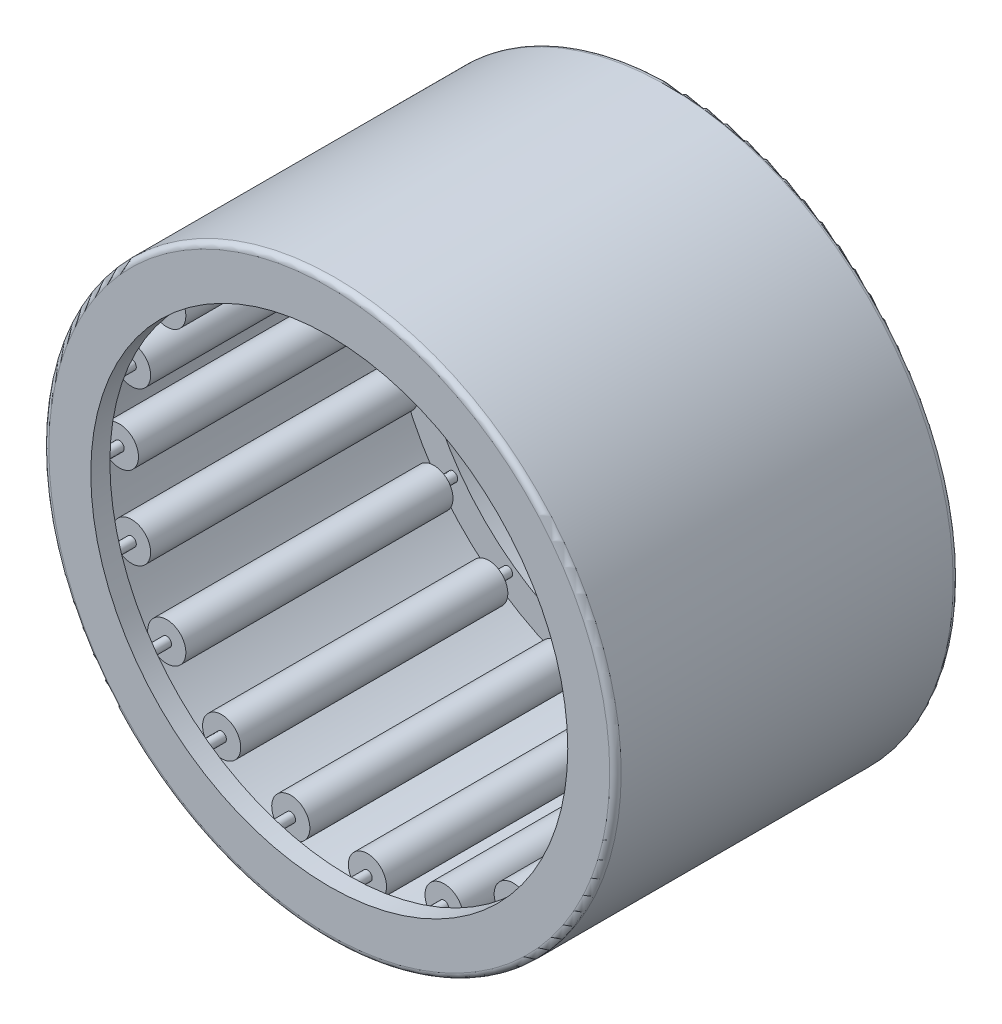
from build123d import *

# Parameters (mm, degrees)
SKETCH2_W         = 14.816666666
SKETCH2_H         = 0.79375
SKETCH3_W         = 16.933333334
SKETCH3_H         = 0.264583334
CIRPATTERN1_COUNT = 20
CIRPATTERN1_ANGLE = 342
FILLET1_R         = 0.3175


with BuildPart() as part:
    # Sketch1 → Revolve1 (revolve)
    with BuildSketch(Plane(origin=(0, 0, 0), x_dir=(0, 0, -1), z_dir=(1, 0, 0)), mode=Mode.PRIVATE) as revolve1_sk:
        Polygon((-9.525, 15.875), (9.525, 15.875), (9.525, 13.229166667), (8.466666667, 13.229166667), (8.466666667, 14.816666667), (-8.466666667, 14.816666667), (-8.466666667, 13.229166667), (-9.525, 13.229166667), align=None)
    revolve(revolve1_sk.sketch.rotate(Axis((0, 0, 9.525), (0, 0, -1)), 90), axis=Axis((0, 0, 9.525), (0, 0, -1)))

    # Fillet1
    fillet1_edges = [part.edges().sort_by_distance(p)[0] for p in [
        (-15.875, 0, 9.525),
        (-15.875, 0, -9.525),
    ]]
    fillet(fillet1_edges, radius=FILLET1_R)


with BuildPart() as body_2:
    # Sketch2 → Revolve2 (revolve)
    with BuildSketch(Plane(origin=(0, 0, 0), x_dir=(0, 0, -1), z_dir=(1, 0, 0)), mode=Mode.PRIVATE) as revolve2_sk:
        with Locations((0, 14.419791667)):
            Rectangle(SKETCH2_W, SKETCH2_H)
    revolve(revolve2_sk.sketch.rotate(Axis((0, 13.758333333, 7.408333333), (0, 0, -1)), 180), axis=Axis((0, 13.758333333, 7.408333333), (0, 0, -1)))


with BuildPart() as body_3:
    # Sketch3 → Revolve3 (revolve)
    with BuildSketch(Plane(origin=(0, 0, 0), x_dir=(0, 0, -1), z_dir=(1, 0, 0)), mode=Mode.PRIVATE) as revolve3_sk:
        with Locations((0, 13.890625)):
            Rectangle(SKETCH3_W, SKETCH3_H)
    revolve(revolve3_sk.sketch.rotate(Axis((0, 13.758333333, 8.466666667), (0, 0, -1)), 90), axis=Axis((0, 13.758333333, 8.466666667), (0, 0, -1)))


with BuildPart() as cirpattern1_1:
    # CirPattern1: pattern copy
    add(body_2.part.rotate(Axis((0, 0, -9.525), (0, 0, 1)), 1 * CIRPATTERN1_ANGLE / (CIRPATTERN1_COUNT - 1)))


with BuildPart() as cirpattern1_2:
    # CirPattern1: pattern copy
    add(body_2.part.rotate(Axis((0, 0, -9.525), (0, 0, 1)), 2 * CIRPATTERN1_ANGLE / (CIRPATTERN1_COUNT - 1)))


with BuildPart() as cirpattern1_3:
    # CirPattern1: pattern copy
    add(body_2.part.rotate(Axis((0, 0, -9.525), (0, 0, 1)), 3 * CIRPATTERN1_ANGLE / (CIRPATTERN1_COUNT - 1)))


with BuildPart() as cirpattern1_4:
    # CirPattern1: pattern copy
    add(body_2.part.rotate(Axis((0, 0, -9.525), (0, 0, 1)), 4 * CIRPATTERN1_ANGLE / (CIRPATTERN1_COUNT - 1)))


with BuildPart() as cirpattern1_5:
    # CirPattern1: pattern copy
    add(body_2.part.rotate(Axis((0, 0, -9.525), (0, 0, 1)), 5 * CIRPATTERN1_ANGLE / (CIRPATTERN1_COUNT - 1)))


with BuildPart() as cirpattern1_6:
    # CirPattern1: pattern copy
    add(body_2.part.rotate(Axis((0, 0, -9.525), (0, 0, 1)), 6 * CIRPATTERN1_ANGLE / (CIRPATTERN1_COUNT - 1)))


with BuildPart() as cirpattern1_7:
    # CirPattern1: pattern copy
    add(body_2.part.rotate(Axis((0, 0, -9.525), (0, 0, 1)), 7 * CIRPATTERN1_ANGLE / (CIRPATTERN1_COUNT - 1)))


with BuildPart() as cirpattern1_8:
    # CirPattern1: pattern copy
    add(body_2.part.rotate(Axis((0, 0, -9.525), (0, 0, 1)), 8 * CIRPATTERN1_ANGLE / (CIRPATTERN1_COUNT - 1)))


with BuildPart() as cirpattern1_9:
    # CirPattern1: pattern copy
    add(body_2.part.rotate(Axis((0, 0, -9.525), (0, 0, 1)), 9 * CIRPATTERN1_ANGLE / (CIRPATTERN1_COUNT - 1)))


with BuildPart() as cirpattern1_10:
    # CirPattern1: pattern copy
    add(body_2.part.rotate(Axis((0, 0, -9.525), (0, 0, 1)), 10 * CIRPATTERN1_ANGLE / (CIRPATTERN1_COUNT - 1)))


with BuildPart() as cirpattern1_11:
    # CirPattern1: pattern copy
    add(body_2.part.rotate(Axis((0, 0, -9.525), (0, 0, 1)), 11 * CIRPATTERN1_ANGLE / (CIRPATTERN1_COUNT - 1)))


with BuildPart() as cirpattern1_12:
    # CirPattern1: pattern copy
    add(body_2.part.rotate(Axis((0, 0, -9.525), (0, 0, 1)), 12 * CIRPATTERN1_ANGLE / (CIRPATTERN1_COUNT - 1)))


with BuildPart() as cirpattern1_13:
    # CirPattern1: pattern copy
    add(body_2.part.rotate(Axis((0, 0, -9.525), (0, 0, 1)), 13 * CIRPATTERN1_ANGLE / (CIRPATTERN1_COUNT - 1)))


with BuildPart() as cirpattern1_14:
    # CirPattern1: pattern copy
    add(body_2.part.rotate(Axis((0, 0, -9.525), (0, 0, 1)), 14 * CIRPATTERN1_ANGLE / (CIRPATTERN1_COUNT - 1)))


with BuildPart() as cirpattern1_15:
    # CirPattern1: pattern copy
    add(body_2.part.rotate(Axis((0, 0, -9.525), (0, 0, 1)), 15 * CIRPATTERN1_ANGLE / (CIRPATTERN1_COUNT - 1)))


with BuildPart() as cirpattern1_16:
    # CirPattern1: pattern copy
    add(body_2.part.rotate(Axis((0, 0, -9.525), (0, 0, 1)), 16 * CIRPATTERN1_ANGLE / (CIRPATTERN1_COUNT - 1)))


with BuildPart() as cirpattern1_17:
    # CirPattern1: pattern copy
    add(body_2.part.rotate(Axis((0, 0, -9.525), (0, 0, 1)), 17 * CIRPATTERN1_ANGLE / (CIRPATTERN1_COUNT - 1)))


with BuildPart() as cirpattern1_18:
    # CirPattern1: pattern copy
    add(body_2.part.rotate(Axis((0, 0, -9.525), (0, 0, 1)), 18 * CIRPATTERN1_ANGLE / (CIRPATTERN1_COUNT - 1)))


with BuildPart() as cirpattern1_19:
    # CirPattern1: pattern copy
    add(body_2.part.rotate(Axis((0, 0, -9.525), (0, 0, 1)), 19 * CIRPATTERN1_ANGLE / (CIRPATTERN1_COUNT - 1)))


with BuildPart() as cirpattern1_20:
    # CirPattern1: pattern copy
    add(body_3.part.rotate(Axis((0, 0, -9.525), (0, 0, 1)), 1 * CIRPATTERN1_ANGLE / (CIRPATTERN1_COUNT - 1)))


with BuildPart() as cirpattern1_21:
    # CirPattern1: pattern copy
    add(body_3.part.rotate(Axis((0, 0, -9.525), (0, 0, 1)), 2 * CIRPATTERN1_ANGLE / (CIRPATTERN1_COUNT - 1)))


with BuildPart() as cirpattern1_22:
    # CirPattern1: pattern copy
    add(body_3.part.rotate(Axis((0, 0, -9.525), (0, 0, 1)), 3 * CIRPATTERN1_ANGLE / (CIRPATTERN1_COUNT - 1)))


with BuildPart() as cirpattern1_23:
    # CirPattern1: pattern copy
    add(body_3.part.rotate(Axis((0, 0, -9.525), (0, 0, 1)), 4 * CIRPATTERN1_ANGLE / (CIRPATTERN1_COUNT - 1)))


with BuildPart() as cirpattern1_24:
    # CirPattern1: pattern copy
    add(body_3.part.rotate(Axis((0, 0, -9.525), (0, 0, 1)), 5 * CIRPATTERN1_ANGLE / (CIRPATTERN1_COUNT - 1)))


with BuildPart() as cirpattern1_25:
    # CirPattern1: pattern copy
    add(body_3.part.rotate(Axis((0, 0, -9.525), (0, 0, 1)), 6 * CIRPATTERN1_ANGLE / (CIRPATTERN1_COUNT - 1)))


with BuildPart() as cirpattern1_26:
    # CirPattern1: pattern copy
    add(body_3.part.rotate(Axis((0, 0, -9.525), (0, 0, 1)), 7 * CIRPATTERN1_ANGLE / (CIRPATTERN1_COUNT - 1)))


with BuildPart() as cirpattern1_27:
    # CirPattern1: pattern copy
    add(body_3.part.rotate(Axis((0, 0, -9.525), (0, 0, 1)), 8 * CIRPATTERN1_ANGLE / (CIRPATTERN1_COUNT - 1)))


with BuildPart() as cirpattern1_28:
    # CirPattern1: pattern copy
    add(body_3.part.rotate(Axis((0, 0, -9.525), (0, 0, 1)), 9 * CIRPATTERN1_ANGLE / (CIRPATTERN1_COUNT - 1)))


with BuildPart() as cirpattern1_29:
    # CirPattern1: pattern copy
    add(body_3.part.rotate(Axis((0, 0, -9.525), (0, 0, 1)), 10 * CIRPATTERN1_ANGLE / (CIRPATTERN1_COUNT - 1)))


with BuildPart() as cirpattern1_30:
    # CirPattern1: pattern copy
    add(body_3.part.rotate(Axis((0, 0, -9.525), (0, 0, 1)), 11 * CIRPATTERN1_ANGLE / (CIRPATTERN1_COUNT - 1)))


with BuildPart() as cirpattern1_31:
    # CirPattern1: pattern copy
    add(body_3.part.rotate(Axis((0, 0, -9.525), (0, 0, 1)), 12 * CIRPATTERN1_ANGLE / (CIRPATTERN1_COUNT - 1)))


with BuildPart() as cirpattern1_32:
    # CirPattern1: pattern copy
    add(body_3.part.rotate(Axis((0, 0, -9.525), (0, 0, 1)), 13 * CIRPATTERN1_ANGLE / (CIRPATTERN1_COUNT - 1)))


with BuildPart() as cirpattern1_33:
    # CirPattern1: pattern copy
    add(body_3.part.rotate(Axis((0, 0, -9.525), (0, 0, 1)), 14 * CIRPATTERN1_ANGLE / (CIRPATTERN1_COUNT - 1)))


with BuildPart() as cirpattern1_34:
    # CirPattern1: pattern copy
    add(body_3.part.rotate(Axis((0, 0, -9.525), (0, 0, 1)), 15 * CIRPATTERN1_ANGLE / (CIRPATTERN1_COUNT - 1)))


with BuildPart() as cirpattern1_35:
    # CirPattern1: pattern copy
    add(body_3.part.rotate(Axis((0, 0, -9.525), (0, 0, 1)), 16 * CIRPATTERN1_ANGLE / (CIRPATTERN1_COUNT - 1)))


with BuildPart() as cirpattern1_36:
    # CirPattern1: pattern copy
    add(body_3.part.rotate(Axis((0, 0, -9.525), (0, 0, 1)), 17 * CIRPATTERN1_ANGLE / (CIRPATTERN1_COUNT - 1)))


with BuildPart() as cirpattern1_37:
    # CirPattern1: pattern copy
    add(body_3.part.rotate(Axis((0, 0, -9.525), (0, 0, 1)), 18 * CIRPATTERN1_ANGLE / (CIRPATTERN1_COUNT - 1)))


with BuildPart() as cirpattern1_38:
    # CirPattern1: pattern copy
    add(body_3.part.rotate(Axis((0, 0, -9.525), (0, 0, 1)), 19 * CIRPATTERN1_ANGLE / (CIRPATTERN1_COUNT - 1)))


solid = Compound([part.part, body_2.part, body_3.part, cirpattern1_1.part, cirpattern1_2.part, cirpattern1_3.part, cirpattern1_4.part, cirpattern1_5.part, cirpattern1_6.part, cirpattern1_7.part, cirpattern1_8.part, cirpattern1_9.part, cirpattern1_10.part, cirpattern1_11.part, cirpattern1_12.part, cirpattern1_13.part, cirpattern1_14.part, cirpattern1_15.part, cirpattern1_16.part, cirpattern1_17.part, cirpattern1_18.part, cirpattern1_19.part, cirpattern1_20.part, cirpattern1_21.part, cirpattern1_22.part, cirpattern1_23.part, cirpattern1_24.part, cirpattern1_25.part, cirpattern1_26.part, cirpattern1_27.part, cirpattern1_28.part, cirpattern1_29.part, cirpattern1_30.part, cirpattern1_31.part, cirpattern1_32.part, cirpattern1_33.part, cirpattern1_34.part, cirpattern1_35.part, cirpattern1_36.part, cirpattern1_37.part, cirpattern1_38.part])
